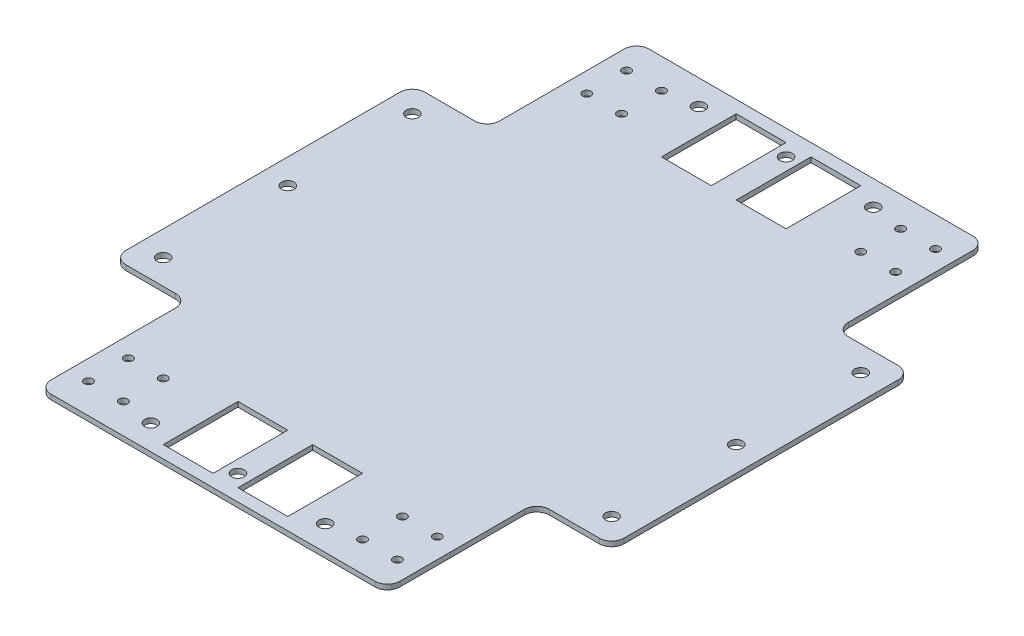
from build123d import *

# Parameters (mm, degrees)
SKETCH_1_R          = 1.7
SKETCH_1_R_2        = 2.5
SKETCH_1_W          = 20
SKETCH_1_H          = 30
EXTRUDE_6_DEPTH     = 2
SKETCH_2_W          = 30
SKETCH_2_H          = 10
CUT_EXTRUDE_2_DEPTH = 2


with BuildPart() as part:
    # 草图1 → 凸台-拉伸6 (new body)
    with BuildSketch(Plane(origin=(0, 0, 0), x_dir=(1, 0, 0), z_dir=(0, 1, 0))):
        with BuildLine():
            Line((-75, 80), (-95, 80))
            ThreePointArc((-95, 80), (-98.535533906, 78.535533906), (-100, 75))
            Line((-100, 75), (-100, -75))
            ThreePointArc((-100, -75), (-98.535533906, -78.535533906), (-95, -80))
            Line((-95, -80), (-75, -80))
            ThreePointArc((-75, -80), (-71.464466094, -81.464466094), (-70, -85))
            Line((-70, -85), (-70, -115))
            ThreePointArc((-70, -115), (-68.535533906, -118.535533906), (-65, -120))
            Line((-65, -120), (65, -120))
            ThreePointArc((65, -120), (68.535533906, -118.535533906), (70, -115))
            Line((70, -115), (70, -85))
            ThreePointArc((70, -85), (71.464466094, -81.464466094), (75, -80))
            Line((75, -80), (95, -80))
            ThreePointArc((95, -80), (98.535533906, -78.535533906), (100, -75))
            Line((100, -75), (100, 75))
            ThreePointArc((100, 75), (98.535533906, 78.535533906), (95, 80))
            Line((95, 80), (75, 80))
            ThreePointArc((75, 80), (71.464466094, 81.464466094), (70, 85))
            Line((70, 85), (70, 115))
            ThreePointArc((70, 115), (68.535533906, 118.535533906), (65, 120))
            Line((65, 120), (-65, 120))
            ThreePointArc((-65, 120), (-68.535533906, 118.535533906), (-70, 115))
            Line((-70, 115), (-70, 85))
            ThreePointArc((-70, 85), (-71.464466094, 81.464466094), (-75, 80))
        make_face()
        with Locations(Location((-62, -108, 0), (0, 0, 270))):
            Circle(SKETCH_1_R, mode=Mode.SUBTRACT)
        with Locations(Location((-48, -108, 0), (0, 0, 270))):
            Circle(SKETCH_1_R, mode=Mode.SUBTRACT)
        with Locations(Location((-62, -92, 0), (0, 0, 270))):
            Circle(SKETCH_1_R, mode=Mode.SUBTRACT)
        with Locations(Location((-48, -92, 0), (0, 0, 270))):
            Circle(SKETCH_1_R, mode=Mode.SUBTRACT)
        with Locations(Location((-35, -110, 0), (0, 0, 270))):
            Circle(SKETCH_1_R_2, mode=Mode.SUBTRACT)
        with Locations((-15, -100)):
            Rectangle(SKETCH_1_W, SKETCH_1_H, mode=Mode.SUBTRACT)
        with Locations(Location((-90, -50, 0), (0, 0, 270))):
            Circle(SKETCH_1_R_2, mode=Mode.SUBTRACT)
        with Locations(Location((0, -110, 0), (0, 0, 270))):
            Circle(SKETCH_1_R_2, mode=Mode.SUBTRACT)
        with Locations((15, -100)):
            Rectangle(SKETCH_1_W, SKETCH_1_H, mode=Mode.SUBTRACT)
        with Locations(Location((35, -110, 0), (0, 0, 270))):
            Circle(SKETCH_1_R_2, mode=Mode.SUBTRACT)
        with Locations(Location((48, -108, 0), (0, 0, 270))):
            Circle(SKETCH_1_R, mode=Mode.SUBTRACT)
        with Locations(Location((62, -108, 0), (0, 0, 270))):
            Circle(SKETCH_1_R, mode=Mode.SUBTRACT)
        with Locations(Location((48, -92, 0), (0, 0, 270))):
            Circle(SKETCH_1_R, mode=Mode.SUBTRACT)
        with Locations(Location((62, -92, 0), (0, 0, 270))):
            Circle(SKETCH_1_R, mode=Mode.SUBTRACT)
        with Locations(Location((90, -50, 0), (0, 0, 270))):
            Circle(SKETCH_1_R_2, mode=Mode.SUBTRACT)
        with Locations(Location((-90, 0, 0), (0, 0, 270))):
            Circle(SKETCH_1_R_2, mode=Mode.SUBTRACT)
        with Locations(Location((-90, 50, 0), (0, 0, 270))):
            Circle(SKETCH_1_R_2, mode=Mode.SUBTRACT)
        with Locations(Location((-62, 92, 0), (0, 0, 270))):
            Circle(SKETCH_1_R, mode=Mode.SUBTRACT)
        with Locations(Location((-62, 108, 0), (0, 0, 270))):
            Circle(SKETCH_1_R, mode=Mode.SUBTRACT)
        with Locations(Location((-48, 108, 0), (0, 0, 270))):
            Circle(SKETCH_1_R, mode=Mode.SUBTRACT)
        with Locations(Location((-48, 92, 0), (0, 0, 270))):
            Circle(SKETCH_1_R, mode=Mode.SUBTRACT)
        with Locations(Location((-35, 110, 0), (0, 0, 270))):
            Circle(SKETCH_1_R_2, mode=Mode.SUBTRACT)
        Polygon((-5, 115), (-5, 100), (-5, 85), (-25, 85), (-25, 115), align=None, mode=Mode.SUBTRACT)
        with Locations(Location((90, 0, 0), (0, 0, 270))):
            Circle(SKETCH_1_R_2, mode=Mode.SUBTRACT)
        with Locations(Location((90, 50, 0), (0, 0, 270))):
            Circle(SKETCH_1_R_2, mode=Mode.SUBTRACT)
        with Locations((15, 100)):
            Rectangle(SKETCH_1_W, SKETCH_1_H, mode=Mode.SUBTRACT)
        with Locations(Location((0, 110, 0), (0, 0, 270))):
            Circle(SKETCH_1_R_2, mode=Mode.SUBTRACT)
        with Locations(Location((35, 110, 0), (0, 0, 270))):
            Circle(SKETCH_1_R_2, mode=Mode.SUBTRACT)
        with Locations(Location((48, 92, 0), (0, 0, 270))):
            Circle(SKETCH_1_R, mode=Mode.SUBTRACT)
        with Locations(Location((62, 92, 0), (0, 0, 270))):
            Circle(SKETCH_1_R, mode=Mode.SUBTRACT)
        with Locations(Location((48, 108, 0), (0, 0, 270))):
            Circle(SKETCH_1_R, mode=Mode.SUBTRACT)
        with Locations(Location((62, 108, 0), (0, 0, 270))):
            Circle(SKETCH_1_R, mode=Mode.SUBTRACT)
    extrude(amount=EXTRUDE_6_DEPTH)

    # 草图2 → 切除-拉伸2 (cut)
    with BuildSketch(Plane(origin=(0, 2, 0), x_dir=(1, 0, 0), z_dir=(0, 1, 0))):
        with BuildLine():
            Line((-70, 75), (-100, 75))
            Line((-100, 75), (-100, 60))
            Line((-100, 60), (-95, 60))
            Line((-95, 60), (-75, 60))
            ThreePointArc((-75, 60), (-71.464466094, 61.464466094), (-70, 65))
            Line((-70, 65), (-70, 75))
        make_face()
        with BuildLine():
            Line((-100, 60), (-100, 55))
            ThreePointArc((-100, 55), (-98.535533906, 58.535533906), (-95, 60))
            Line((-95, 60), (-100, 60))
        make_face()
        with Locations((-85, 80)):
            Rectangle(SKETCH_2_W, SKETCH_2_H)
        with BuildLine():
            Line((100, 55), (100, 60))
            Line((100, 60), (95, 60))
            ThreePointArc((95, 60), (98.535533906, 58.535533906), (100, 55))
        make_face()
        with BuildLine():
            ThreePointArc((75, 60), (71.464466094, 61.464466094), (70, 65))
            Line((70, 65), (70, 75))
            Line((70, 75), (100, 75))
            Line((100, 75), (100, 60))
            Line((100, 60), (75, 60))
        make_face()
        with Locations((85, 80)):
            Rectangle(SKETCH_2_W, SKETCH_2_H)
        with BuildLine():
            ThreePointArc((100, -55), (98.535533906, -58.535533906), (95, -60))
            Line((95, -60), (75, -60))
            ThreePointArc((75, -60), (71.464466094, -61.464466094), (70, -65))
            Line((70, -65), (70, -75))
            Line((70, -75), (100, -75))
            Line((100, -75), (100, -60))
            Line((100, -60), (100, -55))
        make_face()
        with Locations((85, -80)):
            Rectangle(SKETCH_2_W, SKETCH_2_H)
        with Locations((-85, -80)):
            Rectangle(SKETCH_2_W, SKETCH_2_H)
        with BuildLine():
            ThreePointArc((-100, -55), (-98.535533906, -58.535533906), (-95, -60))
            Line((-95, -60), (-75, -60))
            ThreePointArc((-75, -60), (-71.464466094, -61.464466094), (-70, -65))
            Line((-70, -65), (-70, -75))
            Line((-70, -75), (-100, -75))
            Line((-100, -75), (-100, -60))
            Line((-100, -60), (-100, -55))
        make_face()
    extrude(amount=-CUT_EXTRUDE_2_DEPTH, mode=Mode.SUBTRACT)


solid = part.part
